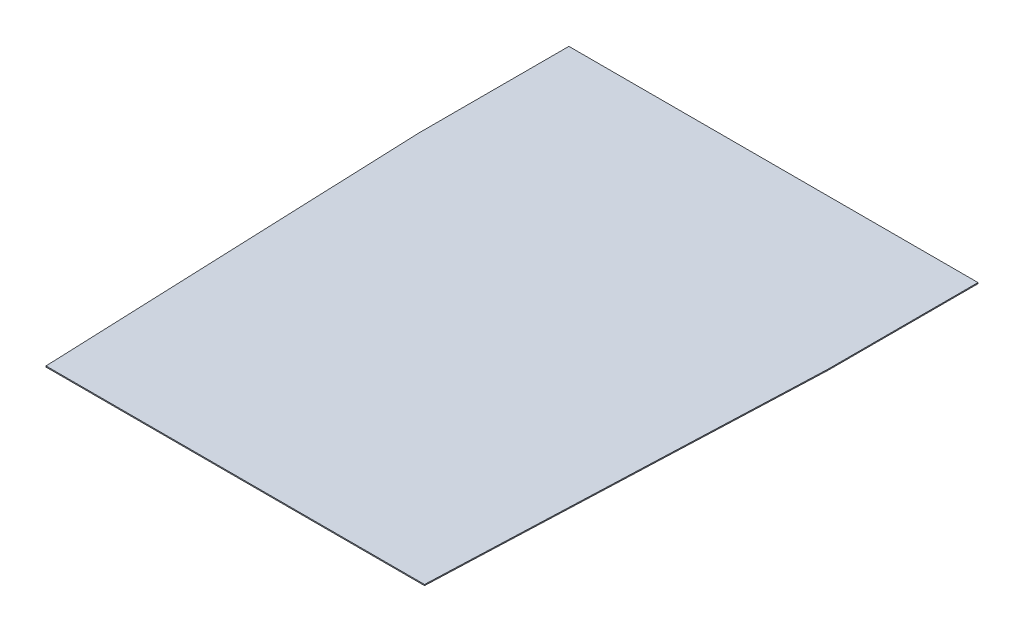
from build123d import *

# Parameters (mm, degrees)
BOSS_EXTRUDE3_DEPTH = 1.6
CUT_EXTRUDE3_DEPTH  = 1249.077106674


with BuildPart() as part:
    # Sketch5 → Boss-Extrude3 (new body)
    with BuildSketch(Plane(origin=(0, 0, 0), x_dir=(1, 0, 0), z_dir=(0, 1, 0))):
        Polygon((0, 0), (628, 0), (628, -230.8), (604.512792249, -826.1), (509.77, -1078.56845133), (118.23, -1078.56845133), (23.487207751, -826.1), (0, -230.8), align=None)
    extrude(amount=BOSS_EXTRUDE3_DEPTH)

    # Sketch6 → Cut-Extrude3 (cut, through all)
    with BuildSketch(Plane(origin=(0, 1.6, 0), x_dir=(1, 0, 0), z_dir=(0, 1, 0))):
        Polygon((23.487207751, -826.1), (604.512792249, -826.1), (509.77, -1078.56845133), (118.23, -1078.56845133), align=None)
    extrude(amount=-CUT_EXTRUDE3_DEPTH, mode=Mode.SUBTRACT)


solid = part.part
